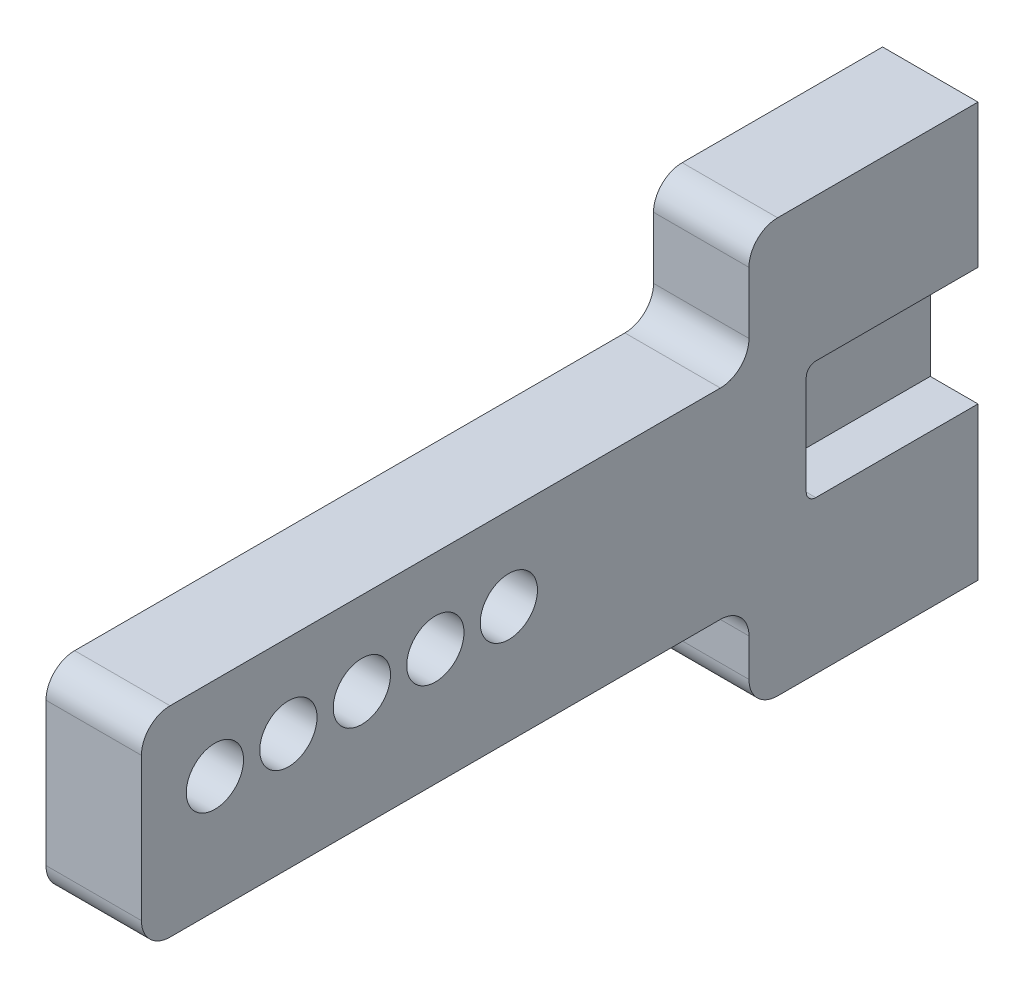
from build123d import *

# Parameters (mm, degrees)
SALIENTE_EXTRUIR1_DEPTH = 10
CROQUIS2_W              = 18
CROQUIS2_H              = 12.394708995
CORTAR_EXTRUIR1_DEPTH   = 5
REDONDEO1_R             = 3
REDONDEO2_R             = 3
REDONDEO3_R             = 1
CROQUIS3_R              = 3
CORTAR_EXTRUIR2_DEPTH   = 15


with BuildPart() as part:
    # Croquis1 → Saliente-Extruir1 (new body)
    with BuildSketch(Plane(origin=(0, 0, 0), x_dir=(0, 0, -1), z_dir=(1, 0, 0))):
        Polygon((0, -10.216508635), (0, 27.394708995), (-24, 27.394708995), (-24, 14.942424084), (-87.663818946, 14.942424084), (-87.663818946, -6.057575916), (-24, -6.057575916), (-24, -16.002849809), (0, -16.002849809), align=None)
    extrude(amount=SALIENTE_EXTRUIR1_DEPTH)

    # Croquis2 → Cortar-Extruir1 (cut)
    with BuildSketch(Plane(origin=(10, 0, 0), x_dir=(0, 0, -1), z_dir=(1, 0, 0))):
        with Locations((-9, 6.197354498)):
            Rectangle(CROQUIS2_W, CROQUIS2_H)
    extrude(amount=-CORTAR_EXTRUIR1_DEPTH, mode=Mode.SUBTRACT)

    # Redondeo1
    redondeo1_edges = [part.edges().sort_by_distance(p)[0] for p in [
        (5, -6.057575916, 24),
        (5, 14.942424084, 24),
    ]]
    fillet(redondeo1_edges, radius=REDONDEO1_R)

    # Redondeo2
    redondeo2_edges = [part.edges().sort_by_distance(p)[0] for p in [
        (5, -16.002849809, 24),
        (5, -6.057575916, 87.663818946),
        (5, 14.942424084, 87.663818946),
        (5, 27.394708995, 24),
    ]]
    fillet(redondeo2_edges, radius=REDONDEO2_R)

    # Redondeo3
    redondeo3_edges = [part.edges().sort_by_distance(p)[0] for p in [
        (7.5, 0, 18),
        (7.5, 12.394708995, 18),
    ]]
    fillet(redondeo3_edges, radius=REDONDEO3_R)

    # Croquis3 → Cortar-Extruir2 (cut)
    with BuildSketch(Plane(origin=(10, 0, 0), x_dir=(0, 0, -1), z_dir=(1, 0, 0))):
        with Locations((-79.963818946, 6.197354497)):
            Circle(CROQUIS3_R)
        with Locations((-72.263818946, 6.197354497)):
            Circle(CROQUIS3_R)
        with Locations((-64.563818946, 6.197354497)):
            Circle(CROQUIS3_R)
        with Locations((-56.863818946, 6.197354497)):
            Circle(CROQUIS3_R)
        with Locations((-49.163818946, 6.197354497)):
            Circle(CROQUIS3_R)
    extrude(amount=-CORTAR_EXTRUIR2_DEPTH, mode=Mode.SUBTRACT)


solid = part.part
